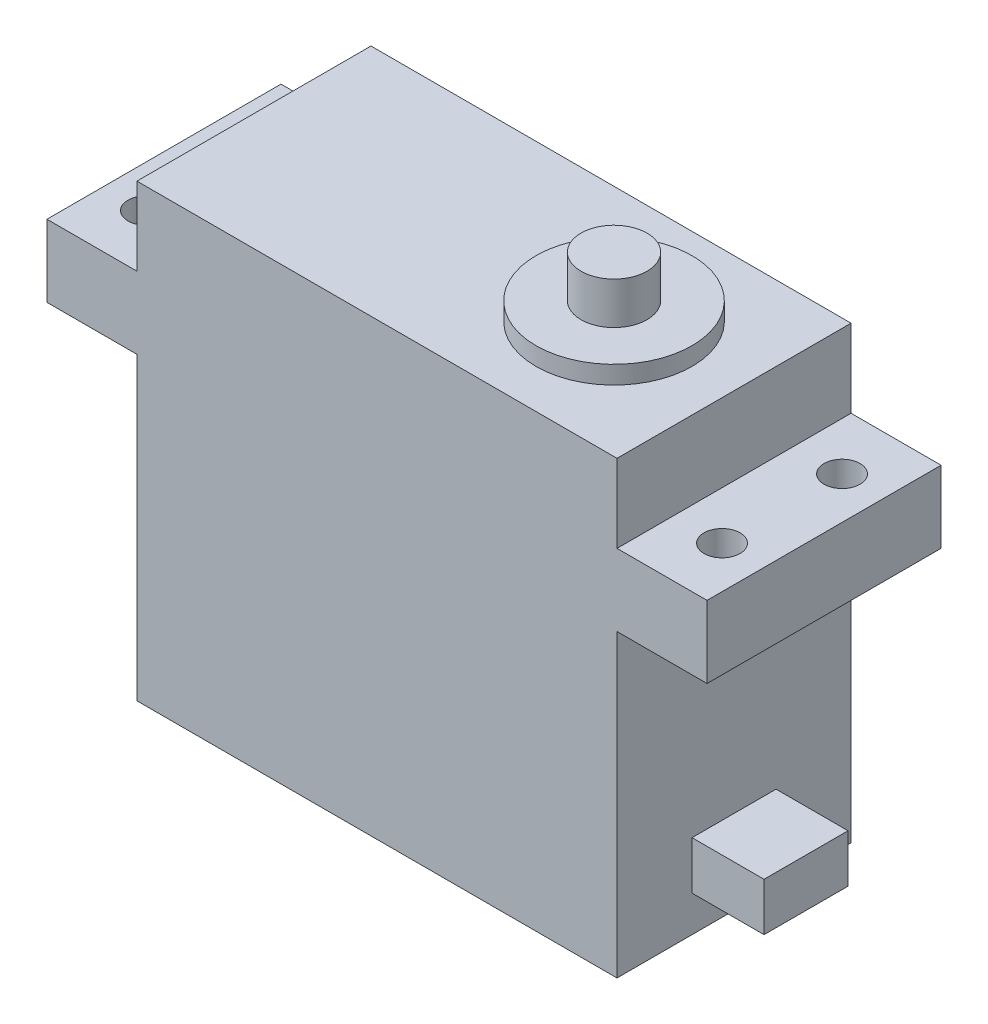
from build123d import *

# Parameters (mm, degrees)
ESQUISSE1_W        = 40
ESQUISSE1_H        = 19.5
BOSS_EXTRU_1_DEPTH = 37.5
ESQUISSE2_R        = 6.5
BOSS_EXTRU_2_DEPTH = 1.5
ESQUISSE3_R        = 2.75
BOSS_EXTRU_3_DEPTH = 3.5
BOSS_EXTRU_4_START = 25
ESQUISSE4_W        = 55
ESQUISSE4_H        = 19.5
ESQUISSE4_R        = 1.5
BOSS_EXTRU_4_DEPTH = 6
ESQUISSE5_W        = 7
ESQUISSE5_H        = 4
BOSS_EXTRU_5_DEPTH = 6


with BuildPart() as part:
    # Esquisse1 → Boss.-Extru.1 (new body)
    with BuildSketch(Plane(origin=(0, 0, 0), x_dir=(1, 0, 0), z_dir=(0, 1, 0))):
        with Locations((-10, 0)):
            Rectangle(ESQUISSE1_W, ESQUISSE1_H)
    extrude(amount=BOSS_EXTRU_1_DEPTH)

    # Esquisse2 → Boss.-Extru.2 (add)
    with BuildSketch(Plane(origin=(0, 37.5, 0), x_dir=(1, 0, 0), z_dir=(0, 1, 0))):
        with Locations(Location((0, 0, 0), (0, 0, 270))):
            Circle(ESQUISSE2_R)
    extrude(amount=BOSS_EXTRU_2_DEPTH)

    # Esquisse3 → Boss.-Extru.3 (add)
    with BuildSketch(Plane(origin=(0, 39, 0), x_dir=(1, 0, 0), z_dir=(0, 1, 0))):
        with Locations(Location((0, 0, 0), (0, 0, 270))):
            Circle(ESQUISSE3_R)
    extrude(amount=BOSS_EXTRU_3_DEPTH)

    # Esquisse4 → Boss.-Extru.4 (add)
    with BuildSketch(Plane(origin=(0, 0, 0), x_dir=(1, 0, 0), z_dir=(0, 1, 0)).offset(BOSS_EXTRU_4_START)):
        with Locations((-10, 0)):
            Rectangle(ESQUISSE4_W, ESQUISSE4_H)
        with Locations(Location((-34, 5, 0), (0, 0, 270))):
            Circle(ESQUISSE4_R, mode=Mode.SUBTRACT)
        with Locations(Location((-34, -5, 0), (0, 0, 90))):
            Circle(ESQUISSE4_R, mode=Mode.SUBTRACT)
        with Locations(Location((14, -5, 0), (0, 0, 270))):
            Circle(ESQUISSE4_R, mode=Mode.SUBTRACT)
        with Locations(Location((14, 5, 0), (0, 0, 90))):
            Circle(ESQUISSE4_R, mode=Mode.SUBTRACT)
    extrude(amount=BOSS_EXTRU_4_DEPTH)

    # Esquisse5 → Boss.-Extru.5 (add)
    with BuildSketch(Plane(origin=(10, 0, 0), x_dir=(0, 0, -1), z_dir=(1, 0, 0))):
        with Locations((0, 5)):
            Rectangle(ESQUISSE5_W, ESQUISSE5_H)
    extrude(amount=BOSS_EXTRU_5_DEPTH)


solid = part.part
